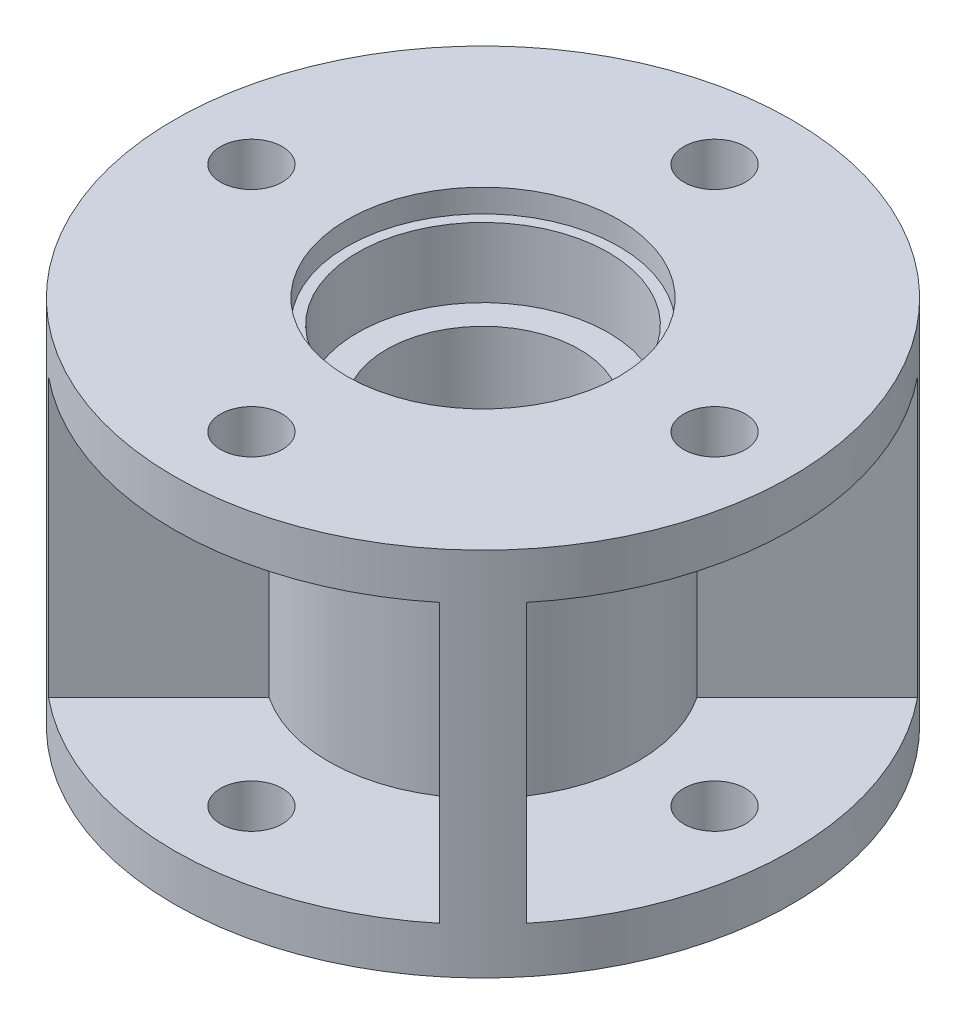
from build123d import *
from build123d.topology import SkipClean

# Parameters (mm, degrees)
SKETCH1_R           = 40
SKETCH1_R_2         = 12.5
BOSS_EXTRUDE1_DEPTH = 6
SKETCH3_R           = 20
SKETCH3_R_2         = 12.5
BOSS_EXTRUDE2_DEPTH = 30
SKETCH4_R           = 20
SKETCH4_R_2         = 16.25
BOSS_EXTRUDE3_DEPTH = 12
BOSS_EXTRUDE4_DEPTH = 42
SKETCH6_R           = 17.6
CUT_EXTRUDE2_DEPTH  = 3
BOSS_EXTRUDE5_START = -6
SKETCH7_R           = 40
SKETCH7_R_2         = 20
BOSS_EXTRUDE5_DEPTH = 6
CUT_EXTRUDE1_REACH  = 76.189
SKETCH2_R           = 4


with BuildPart() as part:
    # Sketch1 → Boss-Extrude1 (new body)
    with BuildSketch(Plane(origin=(0, 0, 0), x_dir=(1, 0, 0), z_dir=(0, 1, 0))):
        with Locations(Location((0, 0, 0), (0, 0, 270))):
            Circle(SKETCH1_R)
        with Locations(Location((0, 0, 0), (0, 0, 270))):
            Circle(SKETCH1_R_2, mode=Mode.SUBTRACT)
    extrude(amount=BOSS_EXTRUDE1_DEPTH)

    # Sketch3 → Boss-Extrude2 (add)
    with BuildSketch(Plane(origin=(0, 6, 0), x_dir=(1, 0, 0), z_dir=(0, 1, 0))):
        with Locations(Location((0, 0, 0), (0, 0, 270))):
            Circle(SKETCH3_R)
        with Locations(Location((0, 0, 0), (0, 0, 270))):
            Circle(SKETCH3_R_2, mode=Mode.SUBTRACT)
    extrude(amount=BOSS_EXTRUDE2_DEPTH)

    # Sketch4 → Boss-Extrude3 (add)
    with BuildSketch(Plane(origin=(0, 36, 0), x_dir=(1, 0, 0), z_dir=(0, 1, 0))):
        with Locations(Location((0, 0, 0), (0, 0, 270))):
            Circle(SKETCH4_R)
        with Locations(Location((0, 0, 0), (0, 0, 270))):
            Circle(SKETCH4_R_2, mode=Mode.SUBTRACT)
    extrude(amount=BOSS_EXTRUDE3_DEPTH)

    # Sketch5 → Boss-Extrude4 (add)
    with SkipClean():  # the faces are left unmerged after this step: merging them gives an invalid solid
        with BuildSketch(Plane(origin=(0, 6, 0), x_dir=(1, 0, 0), z_dir=(0, 1, 0))):
            with BuildLine():
                Line((-16.684833585, -11.027979336), (-30.970921684, -25.314067434))
                ThreePointArc((-30.970921684, -25.314067434), (-28.284271247, -28.284271247), (-25.314067434, -30.970921684))
                Line((-25.314067434, -30.970921684), (-11.027979336, -16.684833585))
                ThreePointArc((-11.027979336, -16.684833585), (-14.142135624, -14.142135624), (-16.684833585, -11.027979336))
            make_face()
            with BuildLine():
                Line((-16.684833585, 11.027979336), (-30.970921684, 25.314067434))
                ThreePointArc((-30.970921684, 25.314067434), (-28.284271247, 28.284271247), (-25.314067434, 30.970921684))
                Line((-25.314067434, 30.970921684), (-11.027979336, 16.684833585))
                ThreePointArc((-11.027979336, 16.684833585), (-14.142135624, 14.142135624), (-16.684833585, 11.027979336))
            make_face()
            with BuildLine():
                Line((11.027979336, 16.684833585), (25.314067434, 30.970921684))
                ThreePointArc((25.314067434, 30.970921684), (28.284271247, 28.284271247), (30.970921684, 25.314067434))
                Line((30.970921684, 25.314067434), (16.684833585, 11.027979336))
                ThreePointArc((16.684833585, 11.027979336), (14.142135624, 14.142135624), (11.027979336, 16.684833585))
            make_face()
            with BuildLine():
                Line((16.684833585, -11.027979336), (30.970921684, -25.314067434))
                ThreePointArc((30.970921684, -25.314067434), (28.284271247, -28.284271247), (25.314067434, -30.970921684))
                Line((25.314067434, -30.970921684), (11.027979336, -16.684833585))
                ThreePointArc((11.027979336, -16.684833585), (14.142135624, -14.142135624), (16.684833585, -11.027979336))
            make_face()
        extrude(amount=BOSS_EXTRUDE4_DEPTH)

    # Sketch6 → Cut-Extrude2 (cut)
    with SkipClean():  # the faces are left unmerged after this step: merging them gives an invalid solid
        with BuildSketch(Plane(origin=(0, 48, 0), x_dir=(1, 0, 0), z_dir=(0, 1, 0))):
            with Locations(Location((0, 0, 0), (0, 0, 270))):
                Circle(SKETCH6_R)
        extrude(amount=-CUT_EXTRUDE2_DEPTH, mode=Mode.SUBTRACT)

    # Sketch7 → Boss-Extrude5 (add)
    with SkipClean():  # the faces are left unmerged after this step: merging them gives an invalid solid
        with BuildSketch(Plane(origin=(0, 48, 0), x_dir=(1, 0, 0), z_dir=(0, 1, 0)).offset(BOSS_EXTRUDE5_START)):
            with Locations(Location((0, 0, 0), (0, 0, 270))):
                Circle(SKETCH7_R)
            Circle(SKETCH7_R_2, mode=Mode.SUBTRACT)
        extrude(amount=BOSS_EXTRUDE5_DEPTH)

    # Cut-Extrude1: up to this face of the body (flat: up to its plane)
    cut_extrude1_end = Plane(part.part.faces().sort_by_distance((0, 48, 29.129034722))[0])
    # Sketch2 → Cut-Extrude1 (cut, up to the picked face)
    with BuildSketch(Plane(origin=(0, 0, 0), x_dir=(1, 0, 0), z_dir=(0, 1, 0)), mode=Mode.PRIVATE) as cut_extrude1_sk1:
        with Locations(Location((0, 30, 0), (0, 0, 270))):
            Circle(SKETCH2_R)
    cut_extrude1_tool1 = split(extrude(cut_extrude1_sk1.sketch, amount=CUT_EXTRUDE1_REACH, mode=Mode.PRIVATE), bisect_by=cut_extrude1_end, keep=Keep.BOTH, mode=Mode.PRIVATE)
    # Sketch2 → Cut-Extrude1 (cut, up to the picked face)
    with BuildSketch(Plane(origin=(0, 0, 0), x_dir=(1, 0, 0), z_dir=(0, 1, 0)), mode=Mode.PRIVATE) as cut_extrude1_sk2:
        with Locations(Location((30, 0, 0), (0, 0, 270))):
            Circle(SKETCH2_R)
    cut_extrude1_tool2 = split(extrude(cut_extrude1_sk2.sketch, amount=CUT_EXTRUDE1_REACH, mode=Mode.PRIVATE), bisect_by=cut_extrude1_end, keep=Keep.BOTH, mode=Mode.PRIVATE)
    # Sketch2 → Cut-Extrude1 (cut, up to the picked face)
    with BuildSketch(Plane(origin=(0, 0, 0), x_dir=(1, 0, 0), z_dir=(0, 1, 0)), mode=Mode.PRIVATE) as cut_extrude1_sk3:
        with Locations(Location((0, -30, 0), (0, 0, 270))):
            Circle(SKETCH2_R)
    cut_extrude1_tool3 = split(extrude(cut_extrude1_sk3.sketch, amount=CUT_EXTRUDE1_REACH, mode=Mode.PRIVATE), bisect_by=cut_extrude1_end, keep=Keep.BOTH, mode=Mode.PRIVATE)
    # Sketch2 → Cut-Extrude1 (cut, up to the picked face)
    with BuildSketch(Plane(origin=(0, 0, 0), x_dir=(1, 0, 0), z_dir=(0, 1, 0)), mode=Mode.PRIVATE) as cut_extrude1_sk4:
        with Locations(Location((-30, 0, 0), (0, 0, 270))):
            Circle(SKETCH2_R)
    cut_extrude1_tool4 = split(extrude(cut_extrude1_sk4.sketch, amount=CUT_EXTRUDE1_REACH, mode=Mode.PRIVATE), bisect_by=cut_extrude1_end, keep=Keep.BOTH, mode=Mode.PRIVATE)
    add(cut_extrude1_tool1.solids().sort_by(Axis((0, 0, -30), (0, 1, 0)))[0], mode=Mode.SUBTRACT)
    add(cut_extrude1_tool2.solids().sort_by(Axis((30, 0, 0), (0, 1, 0)))[0], mode=Mode.SUBTRACT)
    add(cut_extrude1_tool3.solids().sort_by(Axis((0, 0, 30), (0, 1, 0)))[0], mode=Mode.SUBTRACT)
    add(cut_extrude1_tool4.solids().sort_by(Axis((-30, 0, 0), (0, 1, 0)))[0], mode=Mode.SUBTRACT)


solid = part.part
